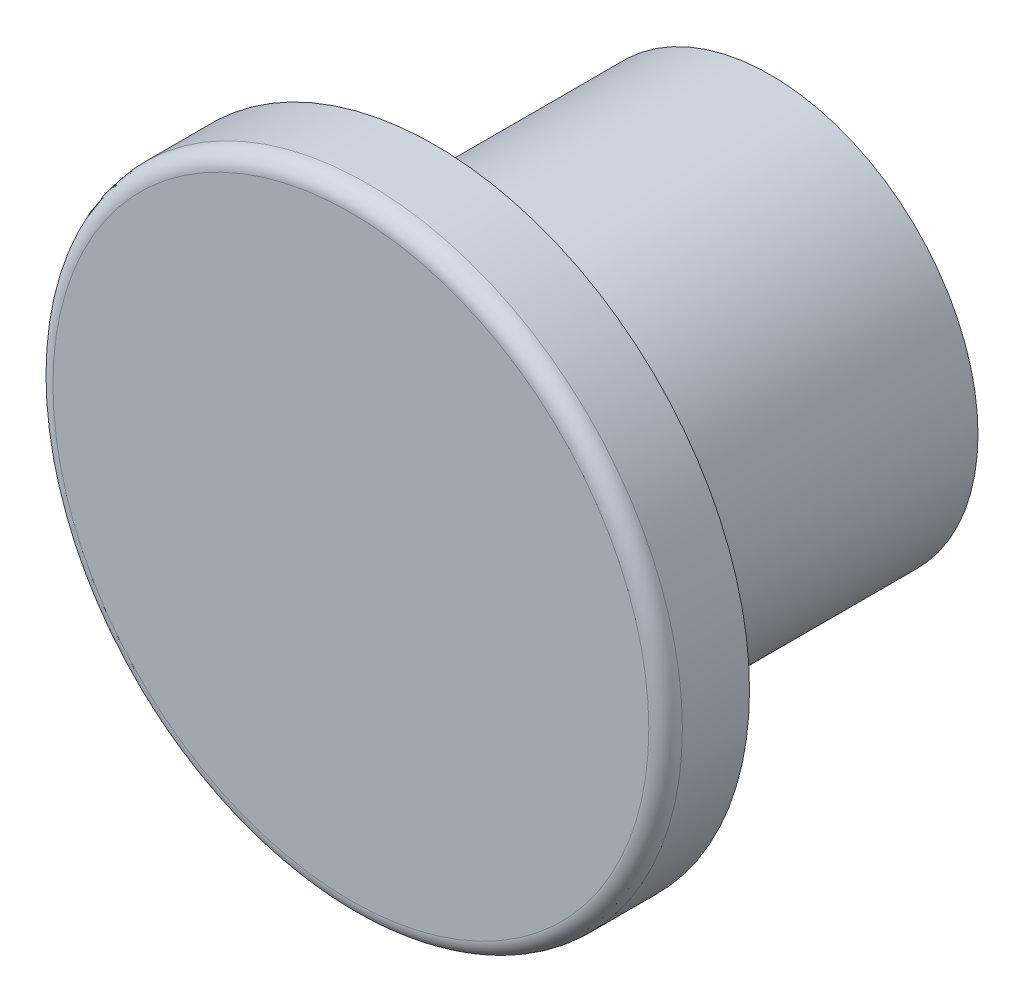
from build123d import *

# Parameters (mm, degrees)
SKETCH1_R           = 7.5
BOSS_EXTRUDE1_DEPTH = 2
SKETCH2_R           = 4.945
BOSS_EXTRUDE2_DEPTH = 10
FILLET2_R           = 0.4


with BuildPart() as part:
    # Sketch1 → Boss-Extrude1 (new body)
    with BuildSketch(Plane.XY):
        Circle(SKETCH1_R)
    extrude(amount=-BOSS_EXTRUDE1_DEPTH)

    # Sketch2 → Boss-Extrude2 (add)
    with BuildSketch(Plane.XY):
        Circle(SKETCH2_R)
    extrude(amount=-BOSS_EXTRUDE2_DEPTH)

    # Fillet2
    fillet2_edges = [part.edges().sort_by_distance(p)[0] for p in [
        (-7.5, 0, 0),
    ]]
    fillet(fillet2_edges, radius=FILLET2_R)


solid = part.part
